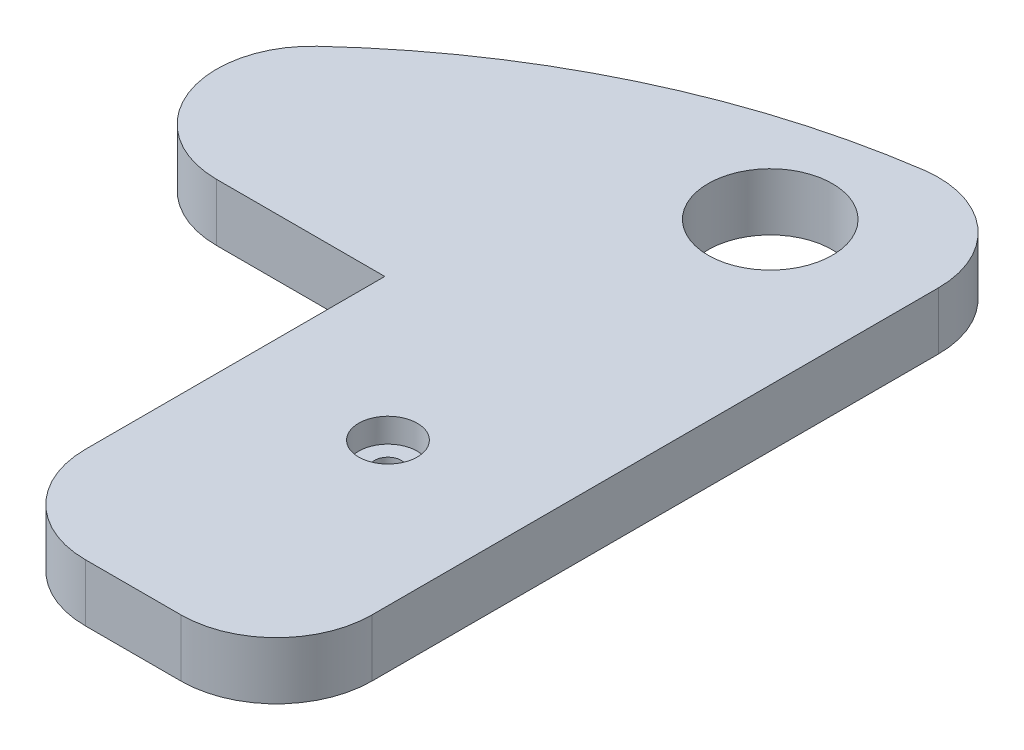
from build123d import *

# Parameters (mm, degrees)
SKETCH1_W           = 22.5
SKETCH1_H           = 60
BOSS_EXTRUDE1_DEPTH = 4.5
CUT_EXTRUDE3_DEPTH  = 1.6
FILLET1_R           = 1
CUT_EXTRUDE4_START  = -1.9
SKETCH5_R           = 2.3
CUT_EXTRUDE4_DEPTH  = 1.9
SKETCH6_R           = 1.05
CUT_EXTRUDE5_DEPTH  = 1
BOSS_EXTRUDE2_DEPTH = 4.5
CUT_EXTRUDE6_DEPTH  = 4.5
SKETCH11_R          = 4.875
CUT_EXTRUDE8_DEPTH  = 4.5
CUT_EXTRUDE9_DEPTH  = 4.5
FILLET2_R           = 7.5
FILLET3_R           = 7.5


with BuildPart() as part:
    # Sketch1 → Boss-Extrude1 (new body)
    with BuildSketch(Plane(origin=(0, 0, 0), x_dir=(1, 0, 0), z_dir=(0, 1, 0))):
        Rectangle(SKETCH1_W, SKETCH1_H)
    extrude(amount=BOSS_EXTRUDE1_DEPTH)

    # Sketch4 → Cut-Extrude3 (cut)
    with BuildSketch(Plane(origin=(-18.455631439, 0, 11.83964206), x_dir=(0, 0, -1), z_dir=(0, -1, 0))):
        with BuildLine():
            Line((4.08964206, 21.947970461), (18.28964206, 20.705631439))
            ThreePointArc((18.28964206, 20.705631439), (20.53964206, 18.455631439), (18.28964206, 16.205631439))
            Line((18.28964206, 16.205631439), (4.08964206, 14.963292417))
            Line((4.08964206, 14.963292417), (4.08964206, 11.213292417))
            ThreePointArc((4.08964206, 11.213292417), (1.83964206, 8.963292417), (-0.41035794, 11.213292417))
            Line((-0.41035794, 11.213292417), (-0.41035794, 15.17326521))
            Line((-0.41035794, 15.17326521), (-12.21035794, 16.205631439))
            ThreePointArc((-12.21035794, 16.205631439), (-14.46035794, 18.455631439), (-12.21035794, 20.705631439))
            Line((-12.21035794, 20.705631439), (-0.41035794, 21.737997669))
            Line((-0.41035794, 21.737997669), (-0.41035794, 25.697970461))
            ThreePointArc((-0.41035794, 25.697970461), (1.83964206, 27.947970461), (4.08964206, 25.697970461))
            Line((4.08964206, 25.697970461), (4.08964206, 21.947970461))
        make_face()
    extrude(amount=-CUT_EXTRUDE3_DEPTH, mode=Mode.SUBTRACT)

    # Fillet1
    fillet1_edges = [part.edges().sort_by_distance(p)[0] for p in [
        (3.492339022, 0.8, 7.75),
        (-3.492339022, 0.8, 7.75),
        (-3.28236623, 0.8, 12.25),
        (3.28236623, 0.8, 12.25),
    ]]
    fillet(fillet1_edges, radius=FILLET1_R)

    # Sketch5 → Cut-Extrude4 (cut)
    with BuildSketch(Plane(origin=(0, 4.5, 0), x_dir=(1, 0, 0), z_dir=(0, 1, 0)).offset(CUT_EXTRUDE4_START)):
        with Locations(Location((0, -10, 0), (0, 0, 270))):
            Circle(SKETCH5_R)
    extrude(amount=CUT_EXTRUDE4_DEPTH, mode=Mode.SUBTRACT)

    # Sketch6 → Cut-Extrude5 (cut)
    with BuildSketch(Plane(origin=(0, 2.6, 0), x_dir=(-1, 0, 0), z_dir=(0, -1, 0))):
        with Locations(Location((0, -10, 0), (0, 0, 90))):
            Circle(SKETCH6_R)
    extrude(amount=CUT_EXTRUDE5_DEPTH, mode=Mode.SUBTRACT)

    # Sketch9 → Boss-Extrude2 (add)
    with BuildSketch(Plane(origin=(0, 4.5, 0), x_dir=(1, 0, 0), z_dir=(0, 1, 0))):
        with BuildLine():
            Line((-48.75, -30), (-11.25, -30))
            Line((-11.25, -30), (-11.25, 25.621488653))
            ThreePointArc((-11.25, 25.621488653), (-38.499371855, 3.541019662), (-48.75, -30))
        make_face()
    extrude(amount=-BOSS_EXTRUDE2_DEPTH)

    # Sketch10 → Cut-Extrude6 (cut)
    with BuildSketch(Plane(origin=(0, 4.5, 0), x_dir=(1, 0, 0), z_dir=(0, 1, 0))):
        with BuildLine():
            ThreePointArc((-11.25, 25.621488653), (-0.211035747, 28.89520065), (11.25, 30))
            Line((11.25, 30), (-11.25, 30))
            Line((-11.25, 30), (-11.25, 25.621488653))
        make_face()
    extrude(amount=-CUT_EXTRUDE6_DEPTH, mode=Mode.SUBTRACT)

    # Sketch11 → Cut-Extrude8 (cut)
    with BuildSketch(Plane(origin=(0, 4.5, 0), x_dir=(1, 0, 0), z_dir=(0, 1, 0))):
        with Locations(Location((0, 20, 0), (0, 0, 270))):
            Circle(SKETCH11_R)
    extrude(amount=-CUT_EXTRUDE8_DEPTH, mode=Mode.SUBTRACT)

    # Sketch12 → Cut-Extrude9 (cut)
    with BuildSketch(Plane(origin=(0, 4.5, 0), x_dir=(1, 0, 0), z_dir=(0, 1, 0))):
        with BuildLine():
            Line((-11.25, 1), (-40.121198156, 1))
            ThreePointArc((-40.121198156, 1), (-46.552560018, -13.910747211), (-48.75, -30))
            Line((-48.75, -30), (-11.25, -30))
            Line((-11.25, -30), (-11.25, 1))
        make_face()
    extrude(amount=-CUT_EXTRUDE9_DEPTH, mode=Mode.SUBTRACT)

    # Fillet2
    fillet2_edges = [part.edges().sort_by_distance(p)[0] for p in [
        (-40.121198156, 2.25, -1),
    ]]
    fillet(fillet2_edges, radius=FILLET2_R)

    # Fillet3
    fillet3_edges = [part.edges().sort_by_distance(p)[0] for p in [
        (-11.25, 2.25, 30),
        (11.25, 2.25, 30),
        (11.25, 2.25, -30),
    ]]
    fillet(fillet3_edges, radius=FILLET3_R)


solid = part.part
